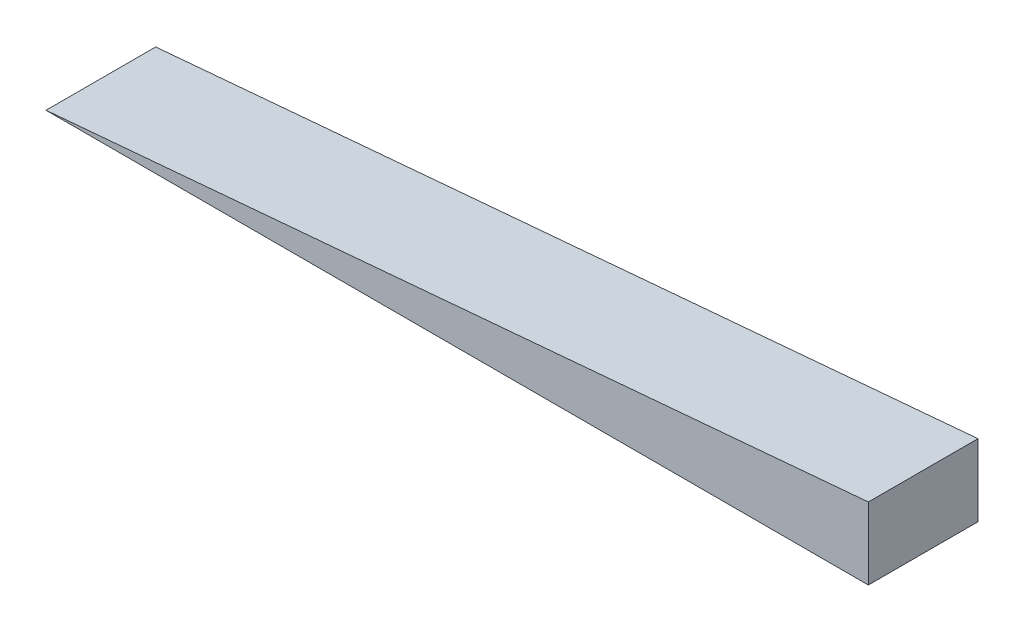
from build123d import *

# Parameters (mm, degrees)
BOSS_EXTRUDE1_DEPTH = 10


with BuildPart() as part:
    # Sketch1 → Boss-Extrude1 (new, symmetric)
    with BuildSketch(Plane.XY):
        Polygon((-104.456448669, 0), (45.543551331, 0), (45.543551331, 13.123299529), align=None)
    extrude(amount=BOSS_EXTRUDE1_DEPTH, both=True)


solid = part.part
